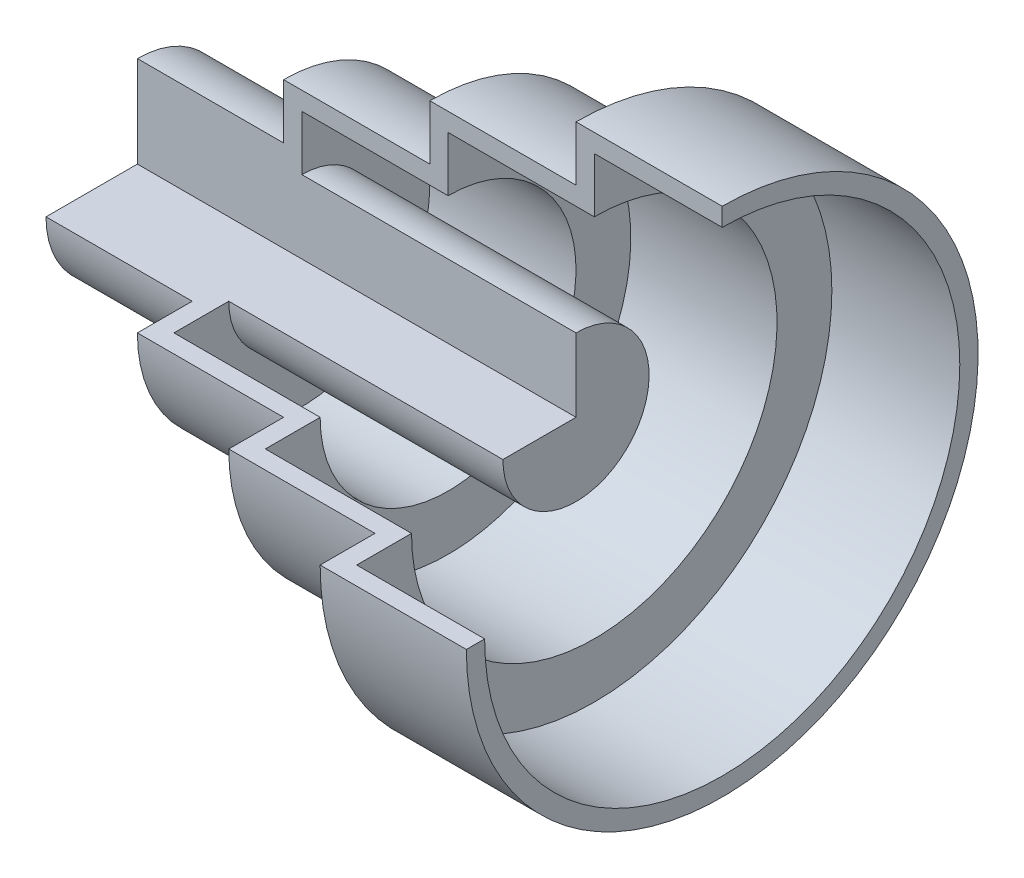
from build123d import *

# Parameters (mm, degrees)
REVOLVE1_ANGLE = 270


with BuildPart() as part:
    # Sketch1 → Revolve1 (revolve)
    with BuildSketch(Plane.XY):
        Polygon((120, 0), (0, 0), (0, 25), (40, 25), (40, 40), (80, 40), (80, 55), (120, 55), (120, 70), (160, 70), (160, 65), (125, 65), (125, 50), (85, 50), (85, 35), (45, 35), (45, 20), (120, 20), align=None)
    revolve(axis=Axis((120, 0, 0), (-1, 0, 0)), revolution_arc=REVOLVE1_ANGLE)


solid = part.part
